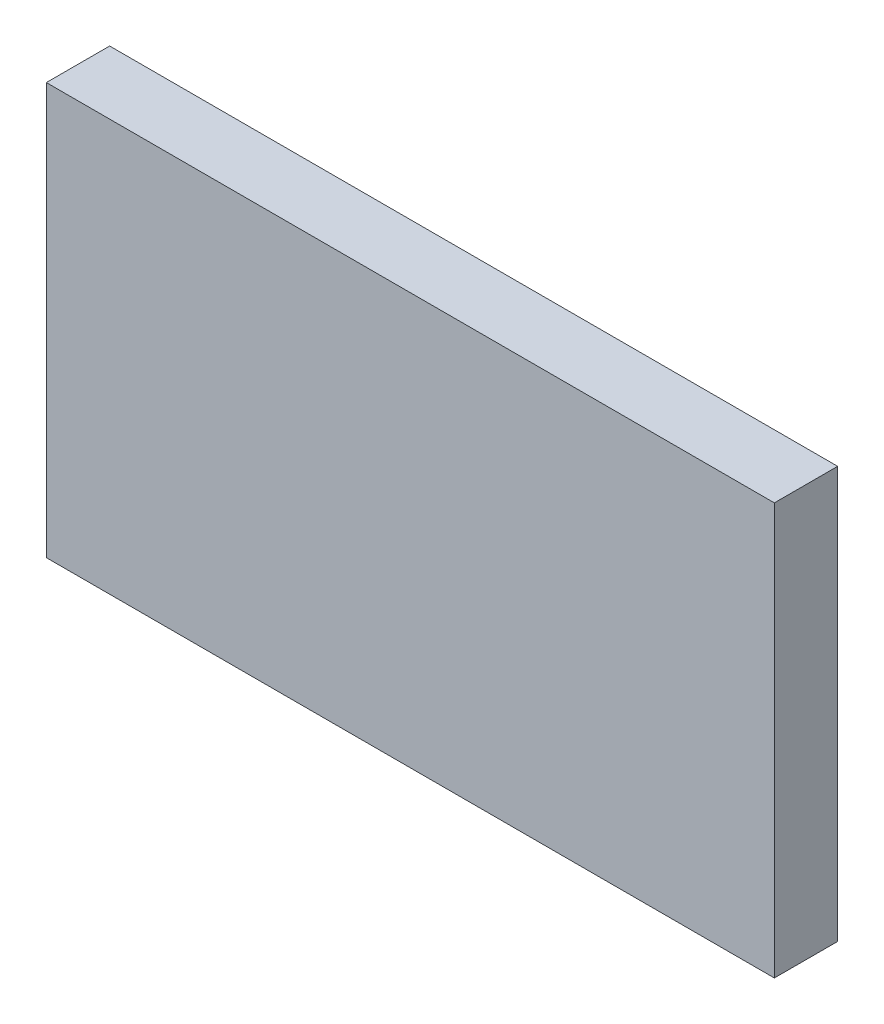
from build123d import *

# Parameters (mm, degrees)
ESBO_O1_W                = 23
ESBO_O1_H                = 13
RESSALTO_EXTRUS_O1_DEPTH = 2


with BuildPart() as part:
    # Esboço1 → Ressalto-extrusão1 (new body)
    with BuildSketch(Plane.XY):
        Rectangle(ESBO_O1_W, ESBO_O1_H)
    extrude(amount=RESSALTO_EXTRUS_O1_DEPTH)


solid = part.part
